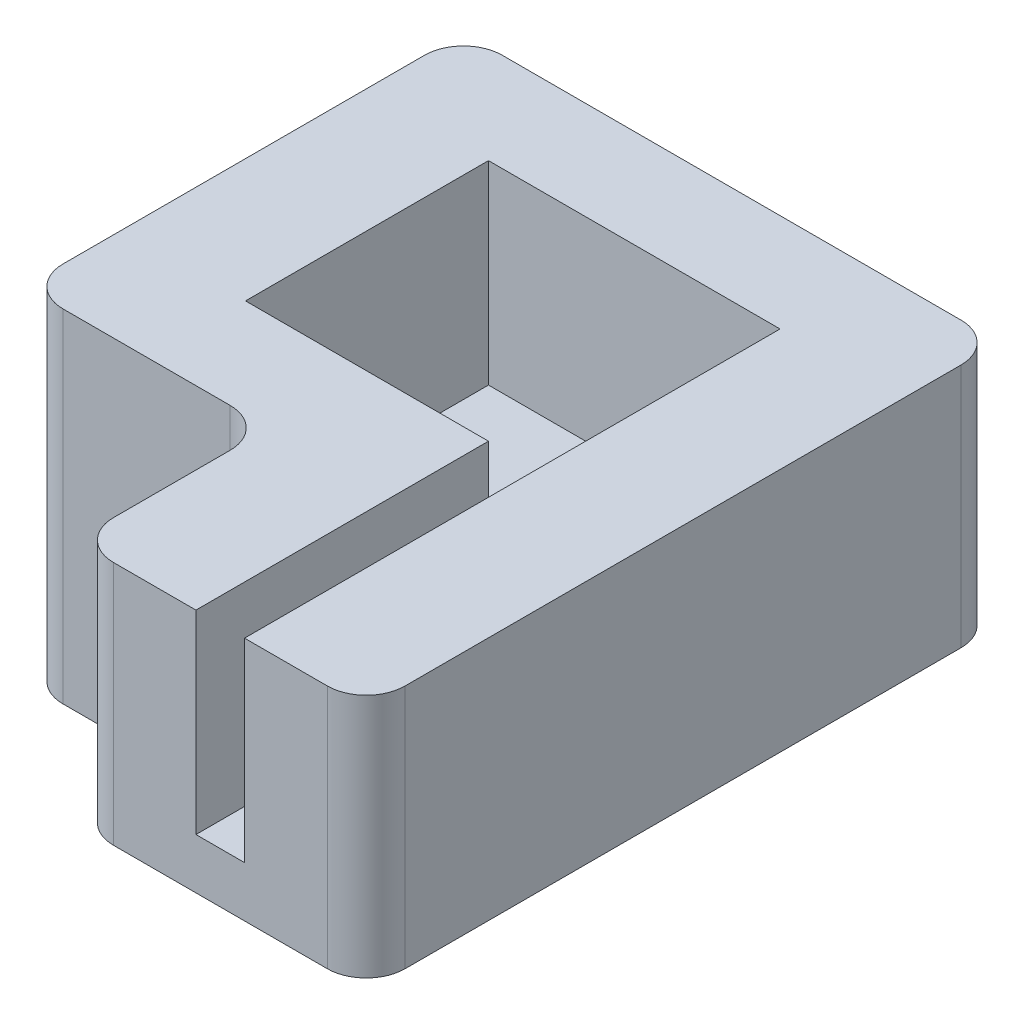
from build123d import *

# Parameters (mm, degrees)
SKETCH1_W           = 35.052
SKETCH1_H           = 28.702
BOSS_EXTRUDE5_DEPTH = 22.352
SKETCH6_W           = 28.702
SKETCH6_H           = 6.35
CUT_EXTRUDE1_DEPTH  = 6.35
SKETCH7_W           = 19.05
SKETCH7_H           = 16.002
BOSS_EXTRUDE6_DEPTH = 12.7
CUT_EXTRUDE2_DEPTH  = 12.7
FILLET5_R           = 2.54
FILLET6_R           = 2.54


with BuildPart() as part:
    # Sketch1 → Boss-Extrude5 (new body)
    with BuildSketch(Plane(origin=(0, 0, 0), x_dir=(1, 0, 0), z_dir=(0, 1, 0))):
        Rectangle(SKETCH1_W, SKETCH1_H)
    extrude(amount=BOSS_EXTRUDE5_DEPTH)

    # Sketch6 → Cut-Extrude1 (cut)
    with BuildSketch(Plane(origin=(17.526, 0, 0), x_dir=(0, 0, -1), z_dir=(1, 0, 0))):
        with Locations((0, 3.175)):
            Rectangle(SKETCH6_W, SKETCH6_H)
    extrude(amount=-CUT_EXTRUDE1_DEPTH, mode=Mode.SUBTRACT)

    # Sketch7 → Boss-Extrude6 (add)
    with BuildSketch(Plane.XY.offset(14.351)):
        with Locations((8.001, 14.351)):
            Rectangle(SKETCH7_W, SKETCH7_H)
    extrude(amount=BOSS_EXTRUDE6_DEPTH)

    # Sketch8 → Cut-Extrude2 (cut)
    with BuildSketch(Plane(origin=(0, 22.352, 0), x_dir=(1, 0, 0), z_dir=(0, 1, 0))):
        Polygon((-9.4742, 7.9375), (-9.4742, -7.9375), (6.4008, -7.9375), (6.4008, -27.051), (9.5758, -27.051), (9.5758, 7.9375), align=None)
    extrude(amount=-CUT_EXTRUDE2_DEPTH, mode=Mode.SUBTRACT)

    # Fillet5
    fillet5_edges = [part.edges().sort_by_distance(p)[0] for p in [
        (11.176, 3.175, -14.351),
        (-1.524, 14.351, 14.351),
        (-17.526, 11.176, 14.351),
        (-17.526, 11.176, -14.351),
        (17.526, 14.351, -14.351),
    ]]
    fillet(fillet5_edges, radius=FILLET5_R)

    # Fillet6
    fillet6_edges = [part.edges().sort_by_distance(p)[0] for p in [
        (11.176, 3.175, 14.351),
        (-1.524, 14.351, 27.051),
        (17.526, 14.351, 27.051),
    ]]
    fillet(fillet6_edges, radius=FILLET6_R)


solid = part.part
